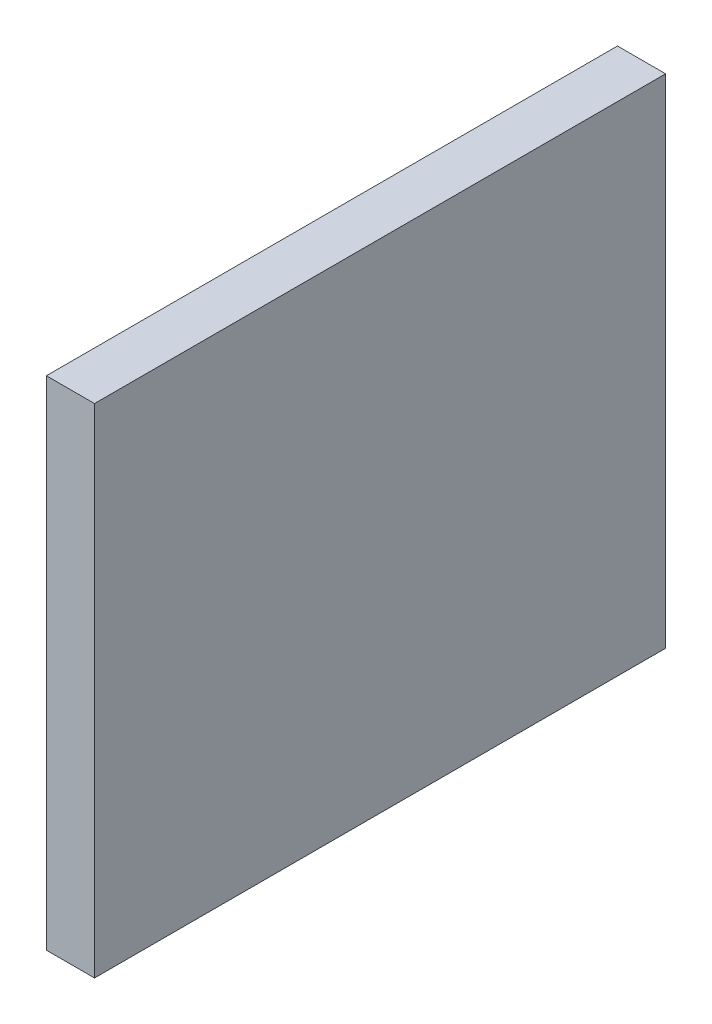
from build123d import *

# Parameters (mm, degrees)
SKETCH1_W           = 19.05
SKETCH1_H           = 196.868531938
BOSS_EXTRUDE1_DEPTH = 226


with BuildPart() as part:
    # Sketch1 → Boss-Extrude1 (new body)
    with BuildSketch(Plane.XY):
        with Locations((-200.475, -151.565734031)):
            Rectangle(SKETCH1_W, SKETCH1_H)
    extrude(amount=BOSS_EXTRUDE1_DEPTH)


solid = part.part
